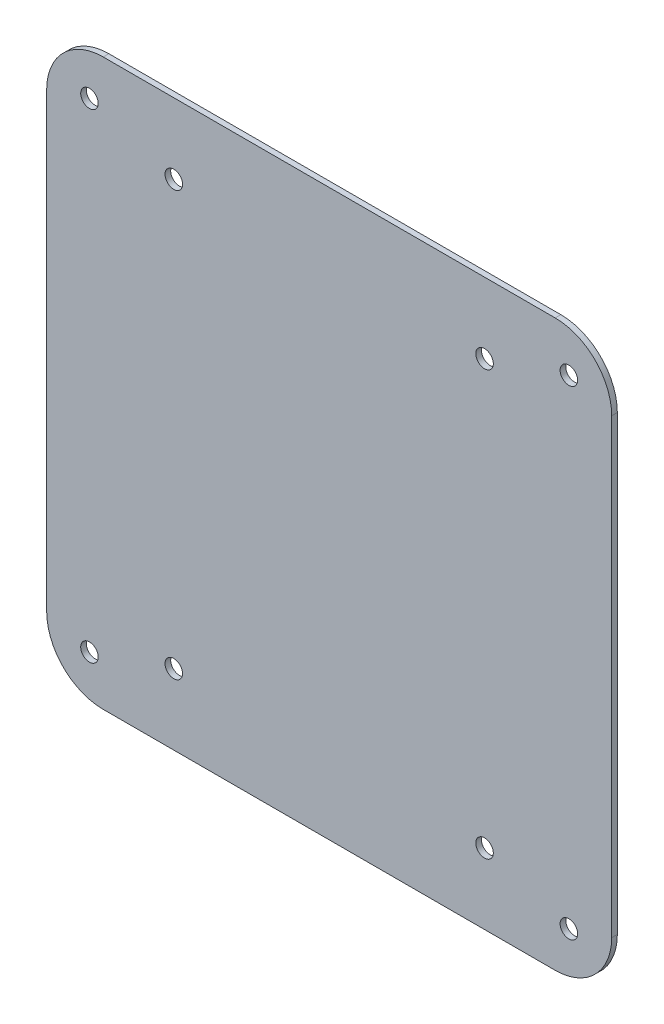
from build123d import *

# Parameters (mm, degrees)
SKETCH_1_R      = 1.55
EXTRUDE_1_DEPTH = 1


with BuildPart() as part:
    # 草图1 → 凸台-拉伸1 (new body)
    with BuildSketch(Plane.XY):
        with BuildLine():
            Line((-40, -50), (40, -50))
            ThreePointArc((40, -50), (47.071067812, -47.071067812), (50, -40))
            Line((50, -40), (50, 40))
            ThreePointArc((50, 40), (47.071067812, 47.071067812), (40, 50))
            Line((40, 50), (-40, 50))
            ThreePointArc((-40, 50), (-47.071067812, 47.071067812), (-50, 40))
            Line((-50, 40), (-50, -40))
            ThreePointArc((-50, -40), (-47.071067812, -47.071067812), (-40, -50))
        make_face()
        with Locations((-27.5, 37.5)):
            Circle(SKETCH_1_R, mode=Mode.SUBTRACT)
        with Locations((27.5, 37.5)):
            Circle(SKETCH_1_R, mode=Mode.SUBTRACT)
        with Locations((27.5, -37.5)):
            Circle(SKETCH_1_R, mode=Mode.SUBTRACT)
        with Locations((-27.5, -37.5)):
            Circle(SKETCH_1_R, mode=Mode.SUBTRACT)
        with Locations((-42.426406871, 42.426406871)):
            Circle(SKETCH_1_R, mode=Mode.SUBTRACT)
        with Locations(Location((42.426406871, 42.426406871, 0), (0, 0, 180))):
            Circle(SKETCH_1_R, mode=Mode.SUBTRACT)
        with Locations((42.426406871, -42.426406871)):
            Circle(SKETCH_1_R, mode=Mode.SUBTRACT)
        with Locations(Location((-42.426406871, -42.426406871, 0), (0, 0, 180))):
            Circle(SKETCH_1_R, mode=Mode.SUBTRACT)
    extrude(amount=EXTRUDE_1_DEPTH)


solid = part.part
